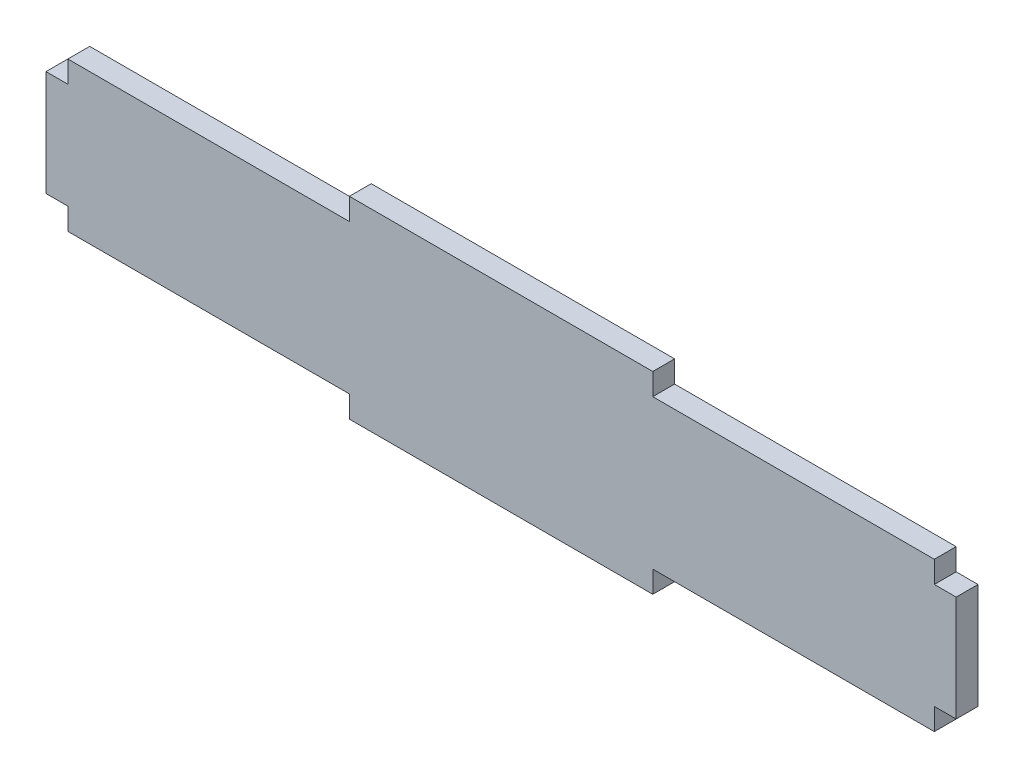
from build123d import *

# Parameters (mm, degrees)
SKETCH1_W           = 500
SKETCH1_H           = 106.02
BOSS_EXTRUDE1_DEPTH = 12
SKETCH2_W           = 12
SKETCH2_H           = 24
CUT_EXTRUDE1_DEPTH  = 512.257508894
SKETCH3_W           = 154.666666667
SKETCH3_H           = 12
CUT_EXTRUDE2_DEPTH  = 512.257508894
SCALE1_SCALE        = 0.5


with BuildPart() as part:
    # Sketch1 → Boss-Extrude1 (new body)
    with BuildSketch(Plane.XY):
        with Locations((250, 53.01)):
            Rectangle(SKETCH1_W, SKETCH1_H)
    extrude(amount=BOSS_EXTRUDE1_DEPTH)

    # Sketch2 → Cut-Extrude1 (cut, through all)
    with BuildSketch(Plane.XY.offset(12)):
        with Locations((494, 12)):
            Rectangle(SKETCH2_W, SKETCH2_H)
        with Locations((494, 94.02)):
            Rectangle(SKETCH2_W, SKETCH2_H)
        with Locations((6, 94.02)):
            Rectangle(SKETCH2_W, SKETCH2_H)
        with Locations((6, 12)):
            Rectangle(SKETCH2_W, SKETCH2_H)
    extrude(amount=-CUT_EXTRUDE1_DEPTH, mode=Mode.SUBTRACT)

    # Sketch3 → Cut-Extrude2 (cut, through all)
    with BuildSketch(Plane.XY.offset(12)):
        with Locations((89.333333334, 6)):
            Rectangle(SKETCH3_W, SKETCH3_H)
        with Locations((410.666666667, 6)):
            Rectangle(SKETCH3_W, SKETCH3_H)
        with Locations((89.333333334, 100.02)):
            Rectangle(SKETCH3_W, SKETCH3_H)
        with Locations((410.666666667, 100.02)):
            Rectangle(SKETCH3_W, SKETCH3_H)
    extrude(amount=-CUT_EXTRUDE2_DEPTH, mode=Mode.SUBTRACT)


with BuildPart() as part_1:
    # Scale1: scaled about (250, 53.01, 6)
    add(part.part.scale(SCALE1_SCALE).moved(Location((125, 26.505, 3))))


solid = part_1.part
